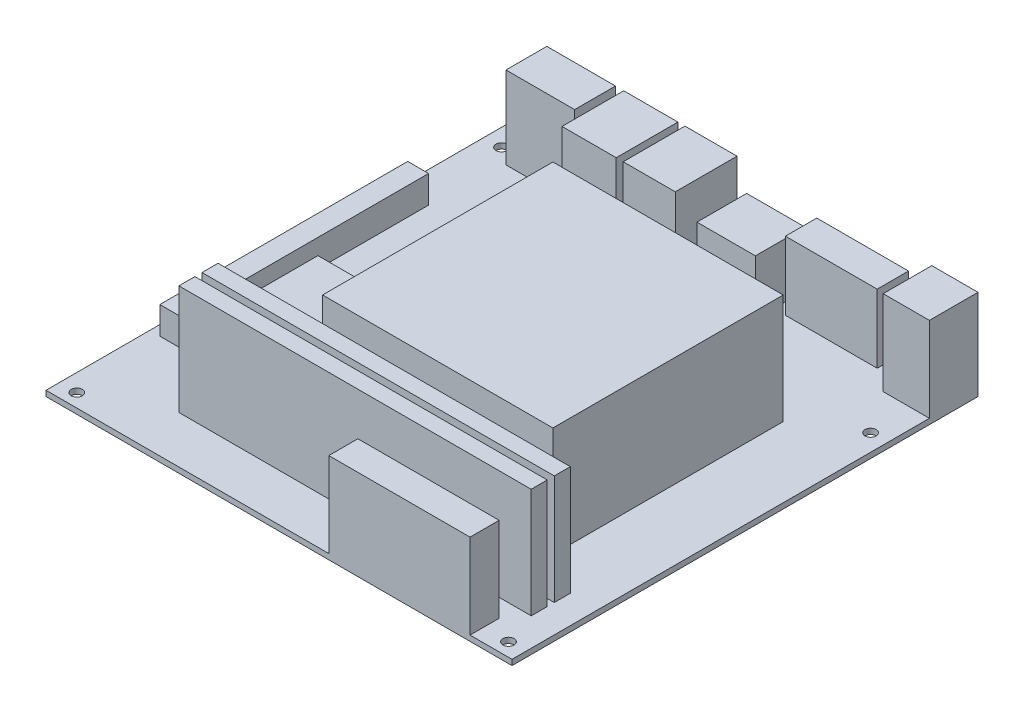
from build123d import *

# Parameters (mm, degrees)
SKETCH1_W           = 170.000000106
SKETCH1_H           = 170.000000106
BOSS_EXTRUDE1_DEPTH = 2
SKETCH2_W           = 128.519017825
SKETCH2_H           = 5.853406533
BOSS_EXTRUDE2_DEPTH = 40
SKETCH3_W           = 84.023612157
SKETCH3_H           = 84.023612156
BOSS_EXTRUDE3_DEPTH = 40
SKETCH4_W           = 25.047517012
SKETCH4_H           = 14.903147005
SKETCH4_W_2         = 19.766346878
SKETCH4_H_2         = 22.517192253
SKETCH4_W_3         = 18.992337586
BOSS_EXTRUDE4_DEPTH = 30
SKETCH5_W           = 21.301196701
SKETCH5_H           = 18.135167802
BOSS_EXTRUDE5_DEPTH = 20
SKETCH6_W           = 33.473309102
SKETCH6_H           = 11.440505981
BOSS_EXTRUDE6_DEPTH = 25
SKETCH7_W           = 16.858518609
SKETCH7_H           = 17.730572085
SKETCH7_W_2         = 51.529446996
SKETCH7_H_2         = 10.618502019
BOSS_EXTRUDE7_DEPTH = 30.95
SKETCH8_W           = 37.52039774
SKETCH8_H           = 34.539531191
SKETCH8_W_2         = 7.616701468
SKETCH8_H_2         = 90.426961443
BOSS_EXTRUDE8_DEPTH = 10
SKETCH9_R           = 2.032
CUT_EXTRUDE1_DEPTH  = 10


with BuildPart() as part:
    # Sketch1 → Boss-Extrude1 (new body)
    with BuildSketch(Plane(origin=(0, 0, 0), x_dir=(1, 0, 0), z_dir=(0, 1, 0))):
        Rectangle(SKETCH1_W, SKETCH1_H)
    extrude(amount=BOSS_EXTRUDE1_DEPTH)

    # Sketch2 → Boss-Extrude2 (add)
    with BuildSketch(Plane(origin=(0, 2, 0), x_dir=(1, 0, 0), z_dir=(0, 1, 0))):
        with Locations((10.509835463, -56.422676592)):
            Rectangle(SKETCH2_W, SKETCH2_H)
        with Locations((10.509835463, -64.84262126)):
            Rectangle(SKETCH2_W, SKETCH2_H)
    extrude(amount=BOSS_EXTRUDE2_DEPTH)

    # Sketch3 → Boss-Extrude3 (add)
    with BuildSketch(Plane(origin=(0, 2, 0), x_dir=(1, 0, 0), z_dir=(0, 1, 0))):
        with Locations((17.355096342, -2.434194161)):
            Rectangle(SKETCH3_W, SKETCH3_H)
    extrude(amount=BOSS_EXTRUDE3_DEPTH)

    # Sketch4 → Boss-Extrude4 (add)
    with BuildSketch(Plane(origin=(0, 2, 0), x_dir=(1, 0, 0), z_dir=(0, 1, 0))):
        with Locations((-59.772791477, 77.548426551)):
            Rectangle(SKETCH4_W, SKETCH4_H)
        with Locations((-34.352625517, 73.741403926)):
            Rectangle(SKETCH4_W_2, SKETCH4_H_2)
        with Locations((-12.41080084, 73.741403926)):
            Rectangle(SKETCH4_W_3, SKETCH4_H_2)
    extrude(amount=BOSS_EXTRUDE4_DEPTH)

    # Sketch5 → Boss-Extrude5 (add)
    with BuildSketch(Plane(origin=(0, 2, 0), x_dir=(1, 0, 0), z_dir=(0, 1, 0))):
        with Locations((11.275402632, 75.932416152)):
            Rectangle(SKETCH5_W, SKETCH5_H)
    extrude(amount=BOSS_EXTRUDE5_DEPTH)

    # Sketch6 → Boss-Extrude6 (add)
    with BuildSketch(Plane(origin=(0, 2, 0), x_dir=(1, 0, 0), z_dir=(0, 1, 0))):
        with Locations((42.922894873, 79.279747063)):
            Rectangle(SKETCH6_W, SKETCH6_H)
    extrude(amount=BOSS_EXTRUDE6_DEPTH)

    # Sketch7 → Boss-Extrude7 (add)
    with BuildSketch(Plane(origin=(0, 2, 0), x_dir=(1, 0, 0), z_dir=(0, 1, 0))):
        with Locations((76.570740749, 76.134714011)):
            Rectangle(SKETCH7_W, SKETCH7_H)
        with Locations((43.928389082, -79.690749044)):
            Rectangle(SKETCH7_W_2, SKETCH7_H_2)
    extrude(amount=BOSS_EXTRUDE7_DEPTH)

    # Sketch8 → Boss-Extrude8 (add)
    with BuildSketch(Plane(origin=(0, 2, 0), x_dir=(1, 0, 0), z_dir=(0, 1, 0))):
        with Locations((-49.174587618, -20.138415223)):
            Rectangle(SKETCH8_W, SKETCH8_H)
        with Locations((-77.515242813, -1.936857576)):
            Rectangle(SKETCH8_W_2, SKETCH8_H_2)
    extrude(amount=BOSS_EXTRUDE8_DEPTH)

    # Sketch9 → Cut-Extrude1 (cut)
    with BuildSketch(Plane(origin=(0, 2, 0), x_dir=(1, 0, 0), z_dir=(0, 1, 0))):
        with Locations(Location((-78.650000053, 74.840000053, 0), (0, 0, 270))):
            Circle(SKETCH9_R)
        with Locations(Location((78.829999947, 51.980000053, 0), (0, 0, 270))):
            Circle(SKETCH9_R)
        with Locations(Location((78.829999947, -80.099999947, 0), (0, 0, 270))):
            Circle(SKETCH9_R)
        with Locations(Location((-78.650000053, -80.099999947, 0), (0, 0, 270))):
            Circle(SKETCH9_R)
    extrude(amount=-CUT_EXTRUDE1_DEPTH, mode=Mode.SUBTRACT)


solid = part.part
